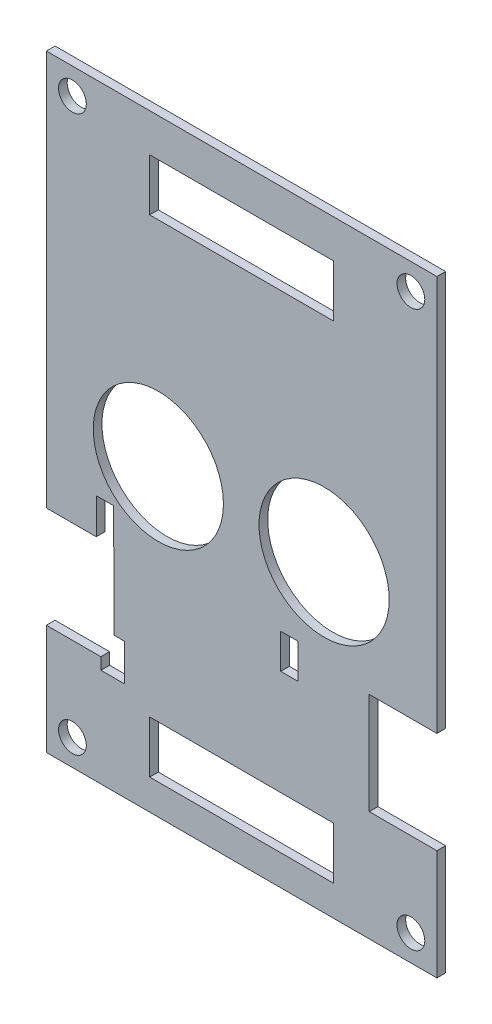
from build123d import *

# Parameters (mm, degrees)
SKETCH1_R           = 1.6
BOSS_EXTRUDE1_DEPTH = 1
SKETCH5_W           = 2
SKETCH5_H           = 4.5
SKETCH5_H_2         = 4
CUT_EXTRUDE1_DEPTH  = 4
SKETCH4_W           = 21.2
SKETCH4_H           = 6
CUT_EXTRUDE2_DEPTH  = 4
SKETCH2_R           = 7.5
CUT_EXTRUDE3_DEPTH  = 4


with BuildPart() as part:
    # Sketch1 → Boss-Extrude1 (new body)
    with BuildSketch(Plane.XY):
        Polygon((20.734205703, -15.283501687), (20.734205703, -27.983501687), (-24.265794297, -27.983501687), (-24.265794297, -15.283501687), (-17.985794297, -15.283501687), (-17.985794297, -16.633501687), (-15.265794297, -16.633501687), (-15.265794297, -12.383501687), (-16.465794297, -12.383501687), (-16.465794297, -3.583501687), (-24.265794297, -3.583501687), (-24.265794297, 42.016498313), (20.734205703, 42.016498313), (20.734205703, -3.583501687), (12.934205703, -3.583501687), (12.934205703, -15.283501687), align=None)
        with Locations((-21.265794297, 39.016498313)):
            Circle(SKETCH1_R, mode=Mode.SUBTRACT)
        with Locations((17.734205703, 39.016498313)):
            Circle(SKETCH1_R, mode=Mode.SUBTRACT)
        with Locations((-21.265794297, -24.983501687)):
            Circle(SKETCH1_R, mode=Mode.SUBTRACT)
        with Locations((17.734205703, -24.983501687)):
            Circle(SKETCH1_R, mode=Mode.SUBTRACT)
    extrude(amount=BOSS_EXTRUDE1_DEPTH)

    # Sketch5 → Cut-Extrude1 (cut)
    with BuildSketch(Plane.XY.offset(1)):
        with Locations((-17.515794297, -1.733501687)):
            Rectangle(SKETCH5_W, SKETCH5_H)
        with Locations((3.734205703, -4.383501687)):
            Rectangle(SKETCH5_W, SKETCH5_H_2)
    extrude(amount=-CUT_EXTRUDE1_DEPTH, mode=Mode.SUBTRACT)

    # Sketch4 → Cut-Extrude2 (cut)
    with BuildSketch(Plane.XY.offset(1)):
        with Locations((-1.765794297, -21.483501687)):
            Rectangle(SKETCH4_W, SKETCH4_H)
        with Locations((-1.765794297, 34.616498313)):
            Rectangle(SKETCH4_W, SKETCH4_H)
    extrude(amount=-CUT_EXTRUDE2_DEPTH, mode=Mode.SUBTRACT)

    # Sketch2 → Cut-Extrude3 (cut)
    with BuildSketch(Plane.XY.offset(1)):
        with Locations((-11.365794297, 7.016498313)):
            Circle(SKETCH2_R)
        with Locations((7.734205703, 7.016498313)):
            Circle(SKETCH2_R)
    extrude(amount=-CUT_EXTRUDE3_DEPTH, mode=Mode.SUBTRACT)


solid = part.part
